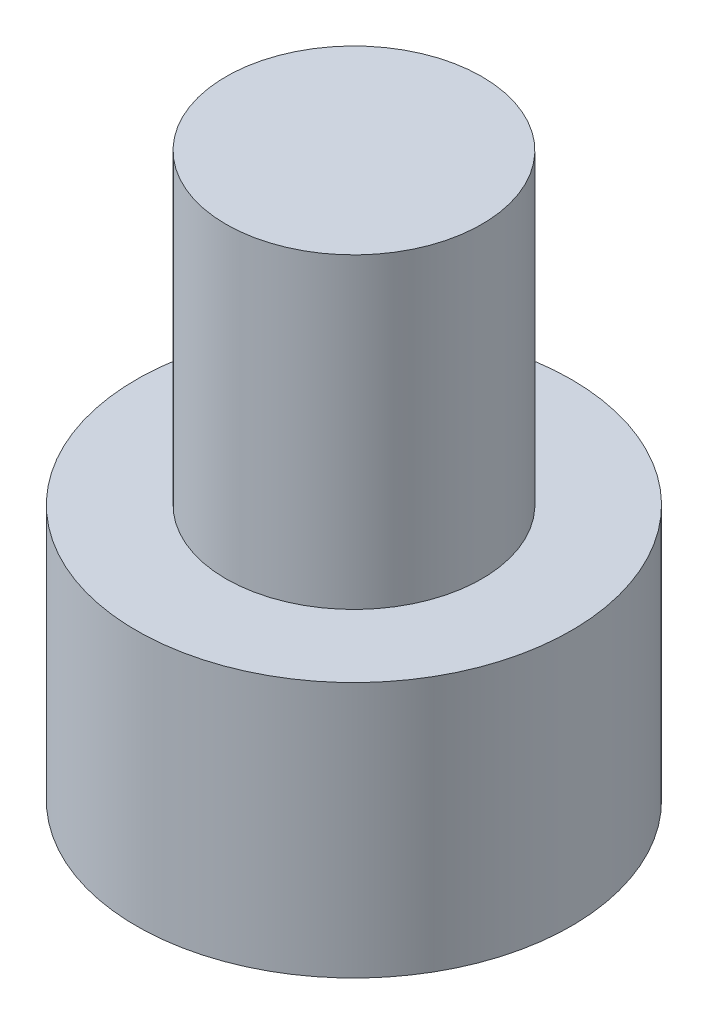
from build123d import *

# Parameters (mm, degrees)
SKETCH_1_R          = 2.5
EXTRUDE_1_DEPTH     = 6
SKETCH_2_R          = 4.25
EXTRUDE_2_DEPTH     = 5
CUT_EXTRUDE_1_DEPTH = 1


with BuildPart() as part:
    # 草图1 → 凸台-拉伸1 (new body)
    with BuildSketch(Plane(origin=(0, 0, 0), x_dir=(1, 0, 0), z_dir=(0, 1, 0))):
        with Locations(Location((0, 0, 0), (0, 0, 270))):
            Circle(SKETCH_1_R)
    extrude(amount=EXTRUDE_1_DEPTH)

    # 草图2 → 凸台-拉伸2 (add)
    with BuildSketch(Plane.XZ):
        with Locations(Location((0, 0, 0), (0, 0, 270))):
            Circle(SKETCH_2_R)
    extrude(amount=EXTRUDE_2_DEPTH)

    # 草图3 → 切除-拉伸1 (cut)
    with BuildSketch(Plane.XZ.offset(5)):
        Polygon((2.309401077, 0), (1.154700538, 2), (-1.154700538, 2), (-2.309401077, 0), (-1.154700538, -2), (1.154700538, -2), align=None)
    extrude(amount=-CUT_EXTRUDE_1_DEPTH, mode=Mode.SUBTRACT)


solid = part.part
